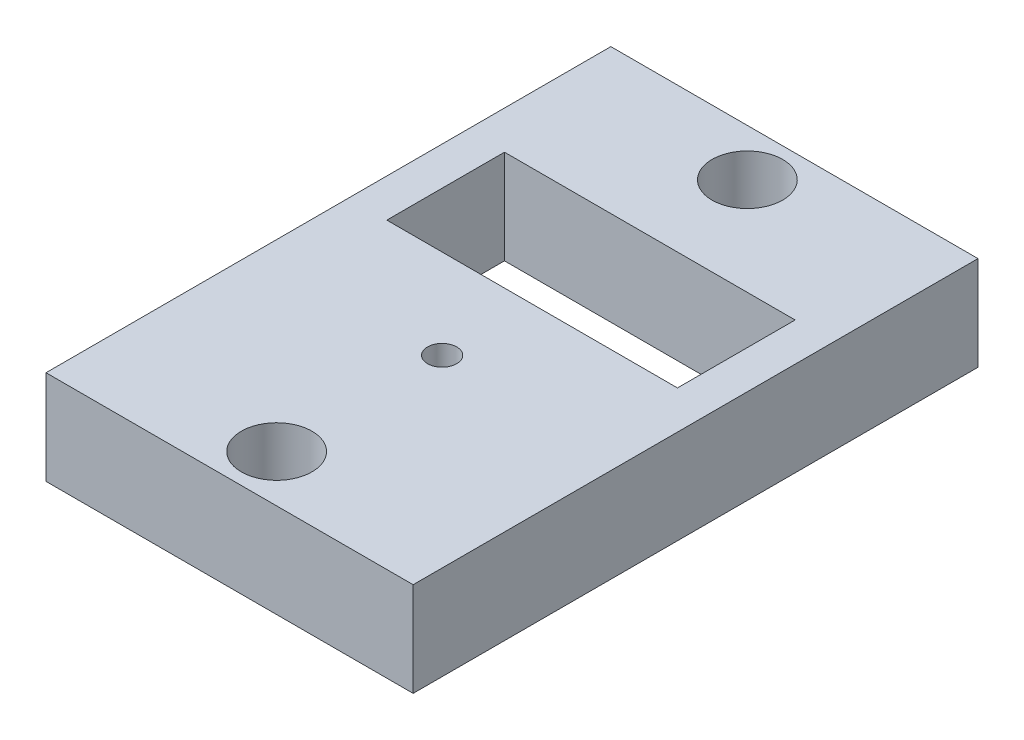
from build123d import *

# Parameters (mm, degrees)
SKETCH1_W           = 78
SKETCH1_H           = 120
BOSS_EXTRUDE1_DEPTH = 10
CUT_EXTRUDE1_REACH  = 102.419
SKETCH2_W           = 61.75
SKETCH2_H           = 25
CUT_EXTRUDE2_REACH  = 102.419
SKETCH3_R           = 7.5
CUT_EXTRUDE3_REACH  = 102.419
SKETCH5_R           = 3.1


with BuildPart() as part:
    # Sketch1 → Boss-Extrude1 (new, symmetric)
    with BuildSketch(Plane(origin=(0, 0, 0), x_dir=(1, 0, 0), z_dir=(0, 1, 0))):
        with Locations((-39, 0)):
            Rectangle(SKETCH1_W, SKETCH1_H)
    extrude(amount=BOSS_EXTRUDE1_DEPTH, both=True)

    # Sketch2 → Cut-Extrude1 (cut, up to next)
    with BuildSketch(Plane(origin=(0, 10, 0), x_dir=(1, 0, 0), z_dir=(0, 1, 0)), mode=Mode.PRIVATE) as cut_extrude1_sk1:
        with Locations((-39, 16.78)):
            Rectangle(SKETCH2_W, SKETCH2_H)
    cut_extrude1_tool1 = extrude(cut_extrude1_sk1.sketch, amount=-CUT_EXTRUDE1_REACH, mode=Mode.PRIVATE) & part.part
    add(cut_extrude1_tool1.solids().sort_by_distance((-39, 10, -16.78))[0], mode=Mode.SUBTRACT)

    # Sketch3 → Cut-Extrude2 (cut, up to next)
    with BuildSketch(Plane(origin=(0, 10, 0), x_dir=(1, 0, 0), z_dir=(0, 1, 0)), mode=Mode.PRIVATE) as cut_extrude2_sk1:
        with Locations(Location((-39, 50, 0), (0, 0, 270))):
            Circle(SKETCH3_R)
    cut_extrude2_tool1 = extrude(cut_extrude2_sk1.sketch, amount=-CUT_EXTRUDE2_REACH, mode=Mode.PRIVATE) & part.part
    # Sketch3 → Cut-Extrude2 (cut, up to next)
    with BuildSketch(Plane(origin=(0, 10, 0), x_dir=(1, 0, 0), z_dir=(0, 1, 0)), mode=Mode.PRIVATE) as cut_extrude2_sk2:
        with Locations(Location((-39, -50, 0), (0, 0, 270))):
            Circle(SKETCH3_R)
    cut_extrude2_tool2 = extrude(cut_extrude2_sk2.sketch, amount=-CUT_EXTRUDE2_REACH, mode=Mode.PRIVATE) & part.part
    add(cut_extrude2_tool1.solids().sort_by_distance((-39, 10, -50))[0], mode=Mode.SUBTRACT)
    add(cut_extrude2_tool2.solids().sort_by_distance((-39, 10, 50))[0], mode=Mode.SUBTRACT)

    # Sketch5 → Cut-Extrude3 (cut, up to next)
    with BuildSketch(Plane(origin=(0, 10, 0), x_dir=(1, 0, 0), z_dir=(0, 1, 0)), mode=Mode.PRIVATE) as cut_extrude3_sk1:
        with Locations(Location((-39.125, -14.72, 0), (0, 0, 270))):
            Circle(SKETCH5_R)
    cut_extrude3_tool1 = extrude(cut_extrude3_sk1.sketch, amount=-CUT_EXTRUDE3_REACH, mode=Mode.PRIVATE) & part.part
    add(cut_extrude3_tool1.solids().sort_by_distance((-39.125, 10, 14.72))[0], mode=Mode.SUBTRACT)


solid = part.part
